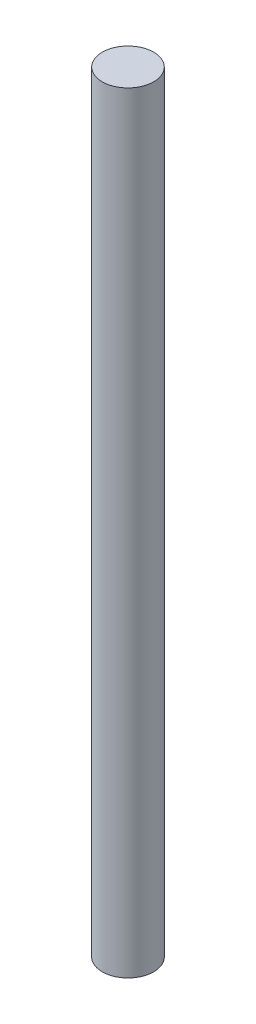
from build123d import *

# Parameters (mm, degrees)
ESBO_O1_R                = 5
RESSALTO_EXTRUS_O1_DEPTH = 150


with BuildPart() as part:
    # Esboço1 → Ressalto-extrusão1 (new body)
    with BuildSketch(Plane(origin=(0, 0, 0), x_dir=(1, 0, 0), z_dir=(0, 1, 0))):
        with Locations(Location((0, 0, 0), (0, 0, 270))):
            Circle(ESBO_O1_R)
    extrude(amount=RESSALTO_EXTRUS_O1_DEPTH)


solid = part.part
